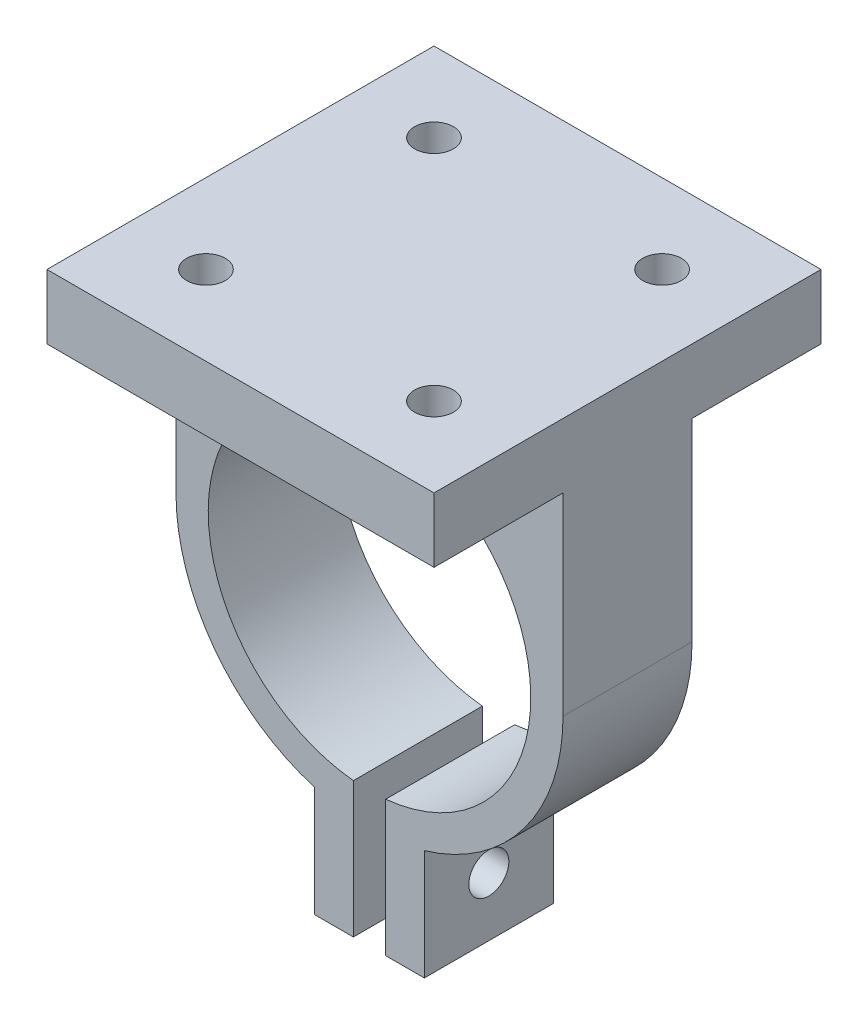
from build123d import *

# Parameters (mm, degrees)
BOSS_EXTRUDE1_DEPTH = 5
SKETCH2_W           = 3
SKETCH2_H           = 10.5
BOSS_EXTRUDE2_DEPTH = 5
CUT_EXTRUDE1_REACH  = 32.359
SKETCH3_R           = 1.55
SKETCH4_W           = 6.16233047
SKETCH4_H           = 10
SKETCH4_W_2         = 6.16
SKETCH4_W_3         = 17.67766953
BOSS_EXTRUDE3_DEPTH = 5


with BuildPart() as part:
    # Sketch1 → Boss-Extrude1 (new, symmetric)
    with BuildSketch(Plane.XY):
        with BuildLine():
            Line((-15, 15), (-15, 0))
            ThreePointArc((-15, 0), (-10.606601721, 10.606601715), (-8e-09, 15))
            Line((-8e-09, 15), (-15, 15))
        make_face()
        with BuildLine():
            Line((15, 15), (-8e-09, 15))
            ThreePointArc((-8e-09, 15), (10.606601715, 10.606601721), (15, 0))
            Line((15, 0), (15, 15))
        make_face()
        with BuildLine():
            ThreePointArc((-8e-09, 15), (-10.606601721, 10.606601715), (-15, 0))
            ThreePointArc((-15, 0), (-11.039701083, -10.155048006), (-1.25, -14.947825929))
            Line((-1.25, -14.947825929), (-1.25, -12.437342964))
            ThreePointArc((-1.25, -12.437342964), (-8.385254916, 9.270248109), (12.5, 0))
            ThreePointArc((12.5, 0), (9.270248109, -8.385254916), (1.25, -12.437342964))
            Line((1.25, -12.437342964), (1.25, -14.947825929))
            ThreePointArc((1.25, -14.947825929), (11.039701083, -10.155048006), (15, 0))
            ThreePointArc((15, 0), (10.606601715, 10.606601721), (-8e-09, 15))
        make_face()
    extrude(amount=BOSS_EXTRUDE1_DEPTH, both=True)

    # Sketch2 → Boss-Extrude2 (add, symmetric)
    with BuildSketch(Plane.XY):
        with Locations((-2.75, -17.687342964)):
            Rectangle(SKETCH2_W, SKETCH2_H)
        with Locations((2.75, -17.687342964)):
            Rectangle(SKETCH2_W, SKETCH2_H)
    extrude(amount=BOSS_EXTRUDE2_DEPTH, both=True)

    # Cut-Extrude1: up to this face of the body (flat: up to its plane)
    cut_extrude1_end = Plane(part.part.faces().sort_by_distance((4.25, -18.661332672, 0))[0])
    # Sketch3 → Cut-Extrude1 (cut, up to the picked face)
    with BuildSketch(Plane.ZY.offset(4.25), mode=Mode.PRIVATE) as cut_extrude1_sk1:
        with Locations(Location((0, -18.385322381, 0), (0, 0, 270))):
            Circle(SKETCH3_R)
    cut_extrude1_tool1 = split(extrude(cut_extrude1_sk1.sketch, amount=-CUT_EXTRUDE1_REACH, mode=Mode.PRIVATE), bisect_by=cut_extrude1_end, keep=Keep.BOTH, mode=Mode.PRIVATE)
    add(cut_extrude1_tool1.solids().sort_by(Axis((-4.25, -18.385322, 0), (1, 0, 0)))[0], mode=Mode.SUBTRACT)

    # Sketch4 → Boss-Extrude3 (add)
    with BuildSketch(Plane(origin=(0, 15, 0), x_dir=(1, 0, 0), z_dir=(0, 1, 0))):
        with BuildLine():
            Line((15, 15), (-15, 15))
            Line((-15, 15), (-15, 5))
            Line((-15, 5), (-8.84, 5))
            Line((-8.84, 5), (-8.84, 7.34))
            ThreePointArc((-8.84, 7.34), (-9.900660172, 9.900660172), (-7.34, 8.84))
            Line((-7.34, 8.84), (7.33766953, 8.84))
            ThreePointArc((7.33766953, 8.84), (8.83766953, 10.34), (10.33766953, 8.84))
            ThreePointArc((10.33766953, 8.84), (9.898329701, 7.779339828), (8.83766953, 7.34))
            Line((8.83766953, 7.34), (8.83766953, 5))
            Line((8.83766953, 5), (15, 5))
            Line((15, 5), (15, 15))
        make_face()
        with Locations((11.918834765, 0)):
            Rectangle(SKETCH4_W, SKETCH4_H)
        with BuildLine():
            Line((-8.84, -5), (-15, -5))
            Line((-15, -5), (-15, -15))
            Line((-15, -15), (15, -15))
            Line((15, -15), (15, -5))
            Line((15, -5), (8.83766953, -5))
            Line((8.83766953, -5), (8.83766953, -7.33766953))
            ThreePointArc((8.83766953, -7.33766953), (9.898329701, -7.777009358), (10.33766953, -8.83766953))
            ThreePointArc((10.33766953, -8.83766953), (8.83766953, -10.33766953), (7.33766953, -8.83766953))
            Line((7.33766953, -8.83766953), (-7.34, -8.83766953))
            ThreePointArc((-7.34, -8.83766953), (-9.900660172, -9.898329701), (-8.84, -7.33766953))
            Line((-8.84, -7.33766953), (-8.84, -5))
        make_face()
        with Locations((-11.92, 0)):
            Rectangle(SKETCH4_W_2, SKETCH4_H)
        with BuildLine():
            Line((8.83766953, -5), (-8.84, -5))
            Line((-8.84, -5), (-8.84, -7.33766953))
            ThreePointArc((-8.84, -7.33766953), (-7.779339828, -7.777009358), (-7.34, -8.83766953))
            Line((-7.34, -8.83766953), (7.33766953, -8.83766953))
            ThreePointArc((7.33766953, -8.83766953), (7.777009358, -7.777009358), (8.83766953, -7.33766953))
            Line((8.83766953, -7.33766953), (8.83766953, -5))
        make_face()
        with Locations((-0.001165235, 0)):
            Rectangle(SKETCH4_W_3, SKETCH4_H)
        with BuildLine():
            Line((-8.84, 7.34), (-8.84, 5))
            Line((-8.84, 5), (8.83766953, 5))
            Line((8.83766953, 5), (8.83766953, 7.34))
            ThreePointArc((8.83766953, 7.34), (7.777009358, 7.779339828), (7.33766953, 8.84))
            Line((7.33766953, 8.84), (-7.34, 8.84))
            ThreePointArc((-7.34, 8.84), (-7.779339828, 7.779339828), (-8.84, 7.34))
        make_face()
    extrude(amount=BOSS_EXTRUDE3_DEPTH)


solid = part.part
